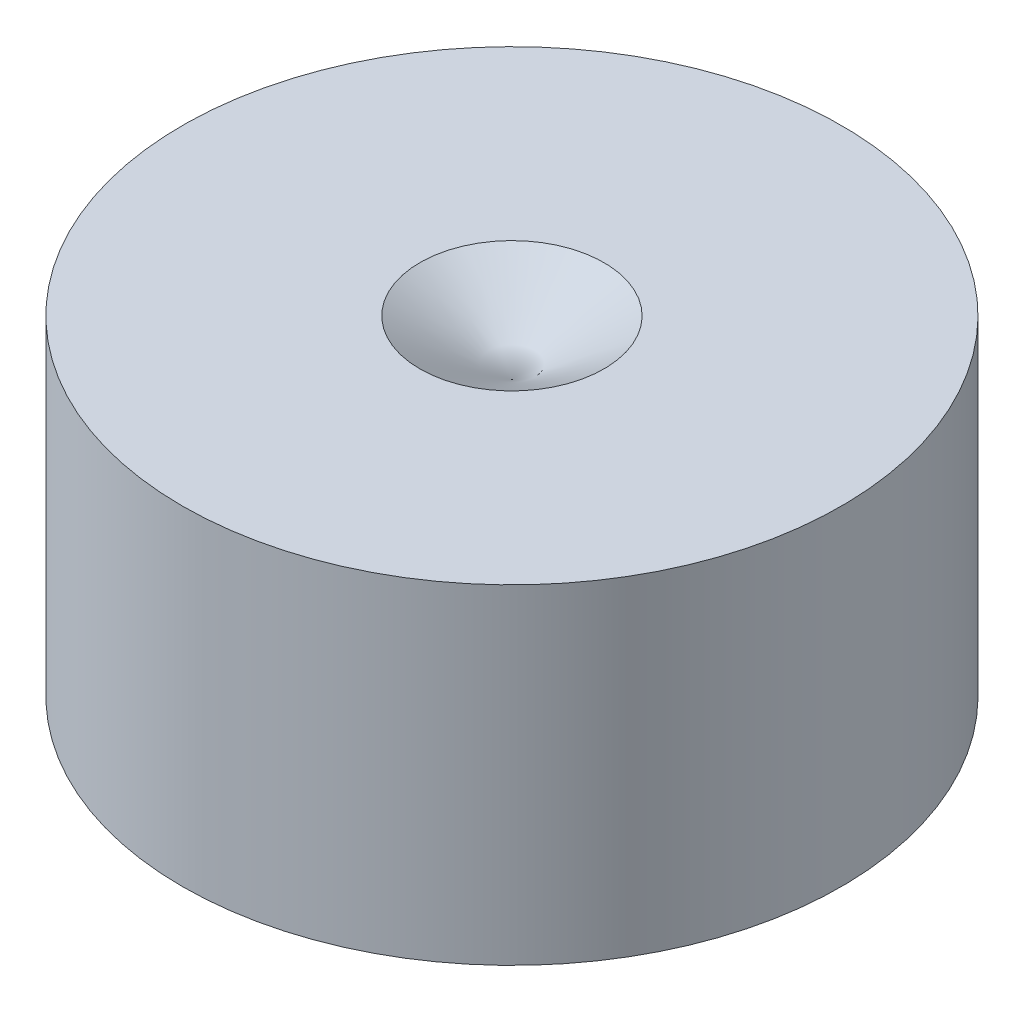
from build123d import *

# Parameters (mm, degrees)
ESQUISSE1_R                                  = 5
BOSS_EXTRU_1_DEPTH                           = 5
CHAMBRAGE_POUR_VIS_T_TE_RONDE_BOMB_E_A_COUNT = 2
CHAMBRAGE_POUR_VIS_T_TE_RONDE_BOMB_E_A_PITCH = 152
CHAMBRAGE_POUR_VIS_T_TE_RONDE_BOMB_2_COUNT   = 2
CHAMBRAGE_POUR_VIS_T_TE_RONDE_BOMB_2_PITCH   = 111
CHAMBRAGE_POUR_VIS_T_TE_RONDE_BOMB_3_COUNT   = 2
CHAMBRAGE_POUR_VIS_T_TE_RONDE_BOMB_3_PITCH   = 188.215302247
CHAMBRAGE_POUR_VIS_T_TE_RONDE_BOMB_4_A_COUNT = 2
CHAMBRAGE_POUR_VIS_T_TE_RONDE_BOMB_4_A_PITCH = 152
CHAMBRAGE_POUR_VIS_T_TE_RONDE_BOMB_5_COUNT   = 2
CHAMBRAGE_POUR_VIS_T_TE_RONDE_BOMB_5_PITCH   = 111
CHAMBRAGE_POUR_VIS_T_TE_RONDE_BOMB_6_COUNT   = 2
CHAMBRAGE_POUR_VIS_T_TE_RONDE_BOMB_6_PITCH   = 188.215302247


with BuildPart() as part:
    # Esquisse1 → Boss.-Extru.1 (new body)
    with BuildSketch(Plane(origin=(0, 0, 0), x_dir=(1, 0, 0), z_dir=(0, 1, 0))):
        with Locations(Location((0, 0, 0), (0, 0, 270))):
            Circle(ESQUISSE1_R)
    extrude(amount=BOSS_EXTRU_1_DEPTH)

    # Esquisse3 → Chambrage pour vis _ t_te ronde bomb_e (revolve, cut)
    with BuildSketch(Plane(origin=(0, 11, -152), x_dir=(0, 0, 1), z_dir=(1, 0, 0))):
        Polygon((0, 0), (0, 6.839402285), (1.397, 6), (1.397, 1.8034), (2.77876, 1.8034), (2.77876, 0.635), (3.41376, 0), align=None)
    chambrage_pour_vis_t_te_ronde_bomb_e = revolve(axis=Axis((0, 17.35, -152), (0, -1, 0)), mode=Mode.SUBTRACT)

    # Chambrage pour vis _ t_te ronde bomb_e a: Chambrage pour vis _ t_te ronde bomb_e ×2
    with Locations(*[(0, 0, i * CHAMBRAGE_POUR_VIS_T_TE_RONDE_BOMB_E_A_PITCH) for i in range(1, CHAMBRAGE_POUR_VIS_T_TE_RONDE_BOMB_E_A_COUNT)]):
        add(chambrage_pour_vis_t_te_ronde_bomb_e, mode=Mode.SUBTRACT)

    # Chambrage pour vis _ t_te ronde bomb 2: Chambrage pour vis _ t_te ronde bomb_e ×2
    with Locations(*[(i * CHAMBRAGE_POUR_VIS_T_TE_RONDE_BOMB_2_PITCH, 0, 0) for i in range(1, CHAMBRAGE_POUR_VIS_T_TE_RONDE_BOMB_2_COUNT)]):
        add(chambrage_pour_vis_t_te_ronde_bomb_e, mode=Mode.SUBTRACT)

    # Chambrage pour vis _ t_te ronde bomb 3: Chambrage pour vis _ t_te ronde bomb_e ×2
    with Locations(*[Vector(0.5897501354816591, 0, 0.8075857711100195) * (i * CHAMBRAGE_POUR_VIS_T_TE_RONDE_BOMB_3_PITCH) for i in range(1, CHAMBRAGE_POUR_VIS_T_TE_RONDE_BOMB_3_COUNT)]):
        add(chambrage_pour_vis_t_te_ronde_bomb_e, mode=Mode.SUBTRACT)

    # Esquisse5 → Chambrage pour vis _ t_te ronde bomb 4 (revolve, cut)
    with BuildSketch(Plane(origin=(0, 11, 0), x_dir=(0, 0, 1), z_dir=(1, 0, 0))):
        Polygon((0, 0), (0, 6.839402285), (1.397, 6), (1.397, 1.8034), (2.77876, 1.8034), (2.77876, 0.635), (3.41376, 0), align=None)
    chambrage_pour_vis_t_te_ronde_bomb_4 = revolve(axis=Axis((0, 17.35, 0), (0, -1, 0)), mode=Mode.SUBTRACT)

    # Chambrage pour vis _ t_te ronde bomb 4 a: Chambrage pour vis _ t_te ronde bomb 4 ×2
    with Locations(*[Vector(-0.4987370820513642, 0, -0.8667533230319286) * (i * CHAMBRAGE_POUR_VIS_T_TE_RONDE_BOMB_4_A_PITCH) for i in range(1, CHAMBRAGE_POUR_VIS_T_TE_RONDE_BOMB_4_A_COUNT)]):
        add(chambrage_pour_vis_t_te_ronde_bomb_4, mode=Mode.SUBTRACT)

    # Chambrage pour vis _ t_te ronde bomb 5: Chambrage pour vis _ t_te ronde bomb 4 ×2
    with Locations(*[Vector(-0.8667533230319285, 0, 0.4987370820513645) * (i * CHAMBRAGE_POUR_VIS_T_TE_RONDE_BOMB_5_PITCH) for i in range(1, CHAMBRAGE_POUR_VIS_T_TE_RONDE_BOMB_5_COUNT)]):
        add(chambrage_pour_vis_t_te_ronde_bomb_4, mode=Mode.SUBTRACT)

    # Chambrage pour vis _ t_te ronde bomb 6: Chambrage pour vis _ t_te ronde bomb 4 ×2
    with Locations(*[Vector(-0.9139408606768702, 0, -0.40584738903339235) * (i * CHAMBRAGE_POUR_VIS_T_TE_RONDE_BOMB_6_PITCH) for i in range(1, CHAMBRAGE_POUR_VIS_T_TE_RONDE_BOMB_6_COUNT)]):
        add(chambrage_pour_vis_t_te_ronde_bomb_4, mode=Mode.SUBTRACT)


solid = part.part
